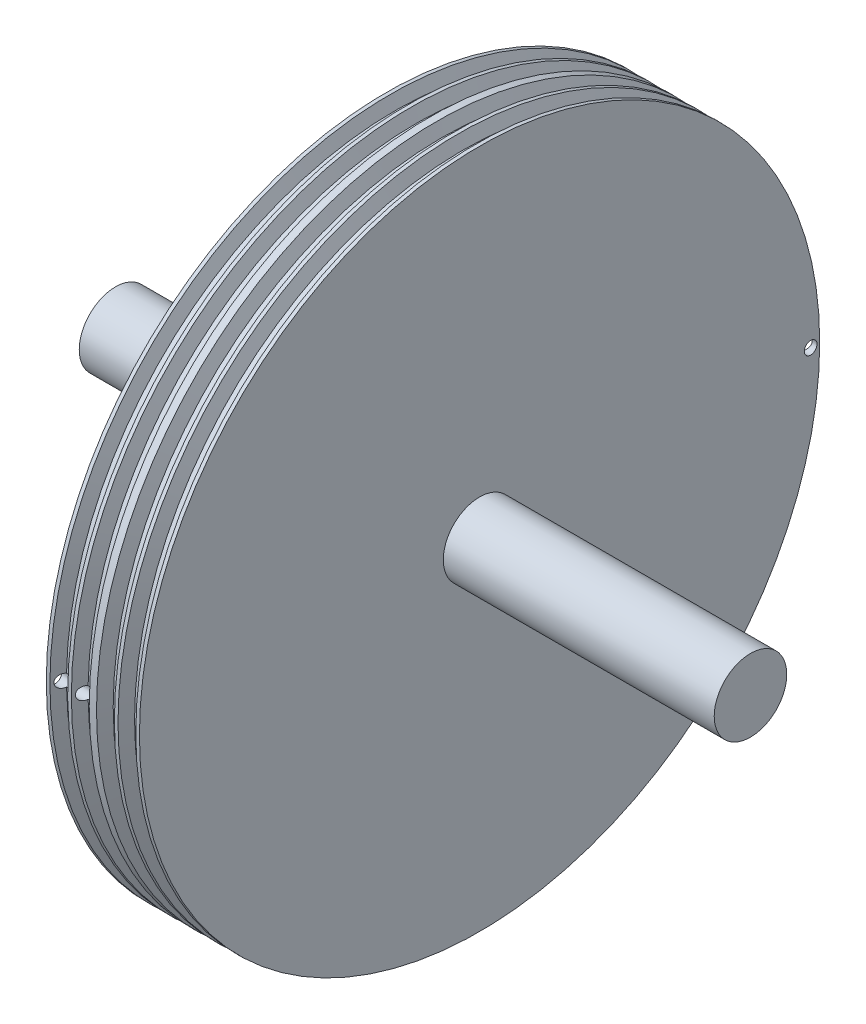
from build123d import *

# Parameters (mm, degrees)
SKETCH3_R          = 0.7
CUT_EXTRUDE1_DEPTH = 4
SKETCH2_R          = 0.7
CUT_EXTRUDE2_DEPTH = 4


with BuildPart() as part:
    # Sketch1 → Revolve1 (revolve)
    with BuildSketch(Plane.XY, mode=Mode.PRIVATE) as revolve1_sk:
        Polygon((35.4, 37.5), (35.98589676, 36.243540344), (36.78589676, 36.243540344), (37.37179352, 37.5), (37.77179352, 37.5), (38.352443595, 36.254791895), (39.152443595, 36.254791895), (39.73309367, 37.5), (40.13309367, 37.5), (40.13309367, 4), (70, 4), (70, 0), (0, 0), (0, 4), (29.86690633, 4), (29.86690633, 37.5), (30.26690633, 37.5), (30.847556405, 36.254791895), (31.647556405, 36.254791895), (32.22820648, 37.5), (32.62820648, 37.5), (33.21410324, 36.243540344), (34.01410324, 36.243540344), (34.6, 37.5), align=None)
    revolve(revolve1_sk.sketch.rotate(Axis((0, 0, 0), (1, 0, 0)), 90), axis=Axis((0, 0, 0), (1, 0, 0)))

    # Sketch3 → Cut-Extrude1 (cut)
    with BuildSketch(Plane(origin=(40.13309367, 0, 0), x_dir=(0, 0, -1), z_dir=(1, 0, 0))):
        with Locations((36.5, 0)):
            Circle(SKETCH3_R)
    extrude(amount=-CUT_EXTRUDE1_DEPTH, mode=Mode.SUBTRACT)

    # Sketch2 → Cut-Extrude2 (cut)
    with BuildSketch(Plane.ZY.offset(-29.86690633)):
        with Locations((36.5, 0)):
            Circle(SKETCH2_R)
    extrude(amount=-CUT_EXTRUDE2_DEPTH, mode=Mode.SUBTRACT)


solid = part.part
